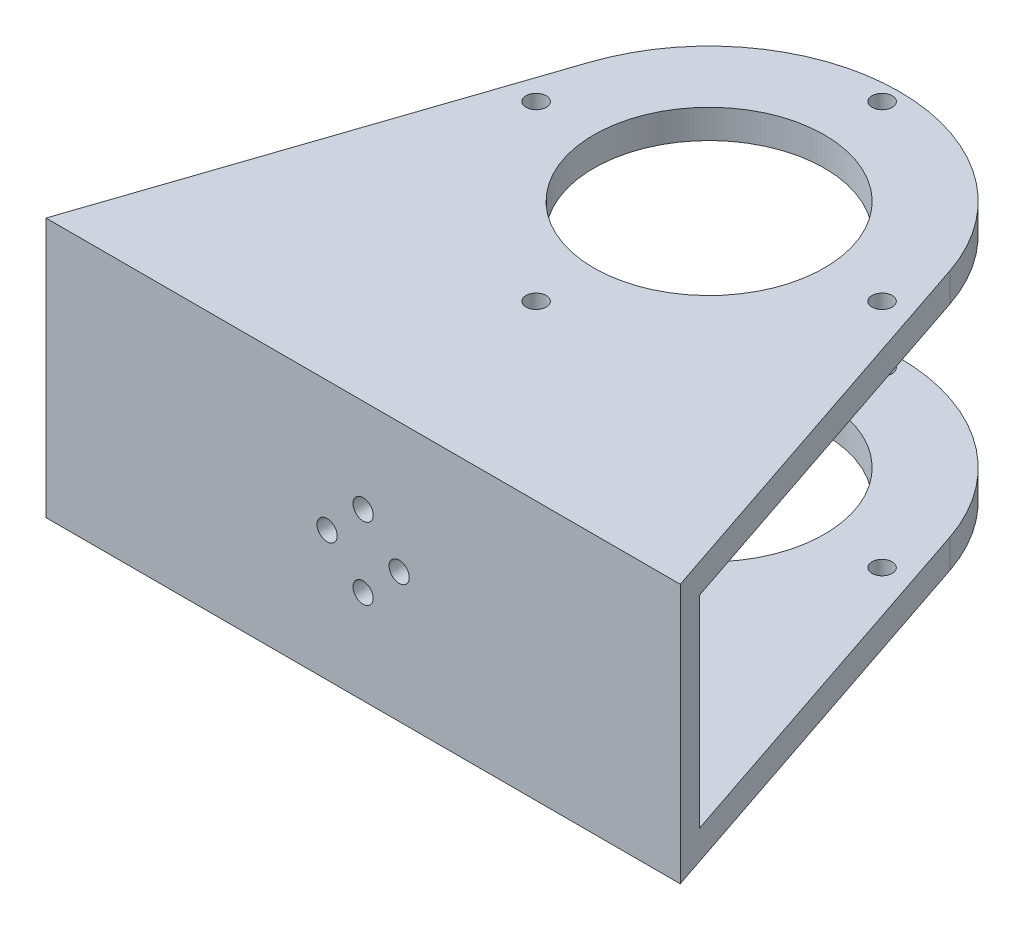
from build123d import *

# Parameters (mm, degrees)
BOSS_EXTRUDE1_DEPTH            = 57.15
SKETCH2_R                      = 25.4
CUT_EXTRUDE1_DEPTH             = 57.15
SKETCH3_R                      = 2.2225
CUT_EXTRUDE2_DEPTH             = 57.15
CIRPATTERN1_COUNT              = 4
CUT_EXTRUDE3_REACH             = 120.117
SKETCH4_W                      = 111.76
SKETCH4_H                      = 44.45
CUT_EXTRUDE3_DIRECTION_2_REACH = 120.117
SKETCH5_R                      = 2.2225
CUT_EXTRUDE4_DEPTH             = 6.35


with BuildPart() as part:
    # Sketch1 → Boss-Extrude1 (new body)
    with BuildSketch(Plane(origin=(0, 0, 0), x_dir=(1, 0, 0), z_dir=(0, 1, 0))):
        with BuildLine():
            Line((-39.722823422, 13.362088137), (-69.85, -76.2))
            Line((-69.85, -76.2), (69.85, -76.2))
            Line((69.85, -76.2), (39.722823422, 13.362088137))
            ThreePointArc((39.722823422, 13.362088137), (0, 41.91), (-39.722823422, 13.362088137))
        make_face()
    extrude(amount=BOSS_EXTRUDE1_DEPTH)

    # Sketch2 → Cut-Extrude1 (cut)
    with BuildSketch(Plane(origin=(0, 57.15, 0), x_dir=(1, 0, 0), z_dir=(0, 1, 0))):
        with Locations(Location((0, 0, 0), (0, 0, 270))):
            Circle(SKETCH2_R)
    extrude(amount=-CUT_EXTRUDE1_DEPTH, mode=Mode.SUBTRACT)

    # Sketch3 → Cut-Extrude2 (cut)
    with BuildSketch(Plane(origin=(0, 57.15, 0), x_dir=(1, 0, 0), z_dir=(0, 1, 0))):
        with Locations(Location((0, 38.1, 0), (0, 0, 270))):
            Circle(SKETCH3_R)
    cut_extrude2 = extrude(amount=-CUT_EXTRUDE2_DEPTH, mode=Mode.SUBTRACT)

    # CirPattern1: Cut-Extrude2 ×4 about axis
    cirpattern1_axis = Axis((0, 0, 0), (0, 1, 0))
    for i in range(1, CIRPATTERN1_COUNT):
        add(cut_extrude2.rotate(cirpattern1_axis, i * 360 / CIRPATTERN1_COUNT), mode=Mode.SUBTRACT)

    # Cut-Extrude3: up to this plane
    cut_extrude3_end = Plane(origin=(-39.722823422, 57.15, -13.362088137), z_dir=(0.9478125369142922, 0, 0.318828158838101))
    # Sketch4 → Cut-Extrude3 (cut, up to the surface)
    with BuildSketch(Plane(origin=(0, 0, 0), x_dir=(0, 0, -1), z_dir=(1, 0, 0)), mode=Mode.PRIVATE) as cut_extrude3_sk1:
        with Locations((-13.97, 28.575)):
            Rectangle(SKETCH4_W, SKETCH4_H)
    cut_extrude3_tool1 = split(extrude(cut_extrude3_sk1.sketch, amount=-CUT_EXTRUDE3_REACH, mode=Mode.PRIVATE), bisect_by=cut_extrude3_end, keep=Keep.BOTH, mode=Mode.PRIVATE)
    add(cut_extrude3_tool1.solids().sort_by_distance((0, 28.575, 13.97))[0], mode=Mode.SUBTRACT)

    # Cut-Extrude3 direction 2: up to this plane
    cut_extrude3_direction_2_end = Plane(origin=(39.722823422, 57.15, -13.362088137), z_dir=(0.9478125369142922, 0, -0.318828158838101))
    # Sketch4 → Cut-Extrude3 direction 2 (cut, up to the surface)
    with BuildSketch(Plane(origin=(0, 0, 0), x_dir=(0, 0, -1), z_dir=(1, 0, 0)), mode=Mode.PRIVATE) as cut_extrude3_direction_2_sk1:
        with Locations((-13.97, 28.575)):
            Rectangle(SKETCH4_W, SKETCH4_H)
    cut_extrude3_direction_2_tool1 = split(extrude(cut_extrude3_direction_2_sk1.sketch, amount=CUT_EXTRUDE3_DIRECTION_2_REACH, mode=Mode.PRIVATE), bisect_by=cut_extrude3_direction_2_end, keep=Keep.BOTH, mode=Mode.PRIVATE)
    add(cut_extrude3_direction_2_tool1.solids().sort_by_distance((0, 28.575, 13.97))[0], mode=Mode.SUBTRACT)

    # Sketch5 → Cut-Extrude4 (cut)
    with BuildSketch(Plane.XY.offset(76.2)):
        with Locations((0, 36.5125)):
            Circle(SKETCH5_R)
        with Locations((-7.9375, 28.575)):
            Circle(SKETCH5_R)
        with Locations((0, 20.6375)):
            Circle(SKETCH5_R)
        with Locations((7.9375, 28.575)):
            Circle(SKETCH5_R)
    extrude(amount=-CUT_EXTRUDE4_DEPTH, mode=Mode.SUBTRACT)


solid = part.part
